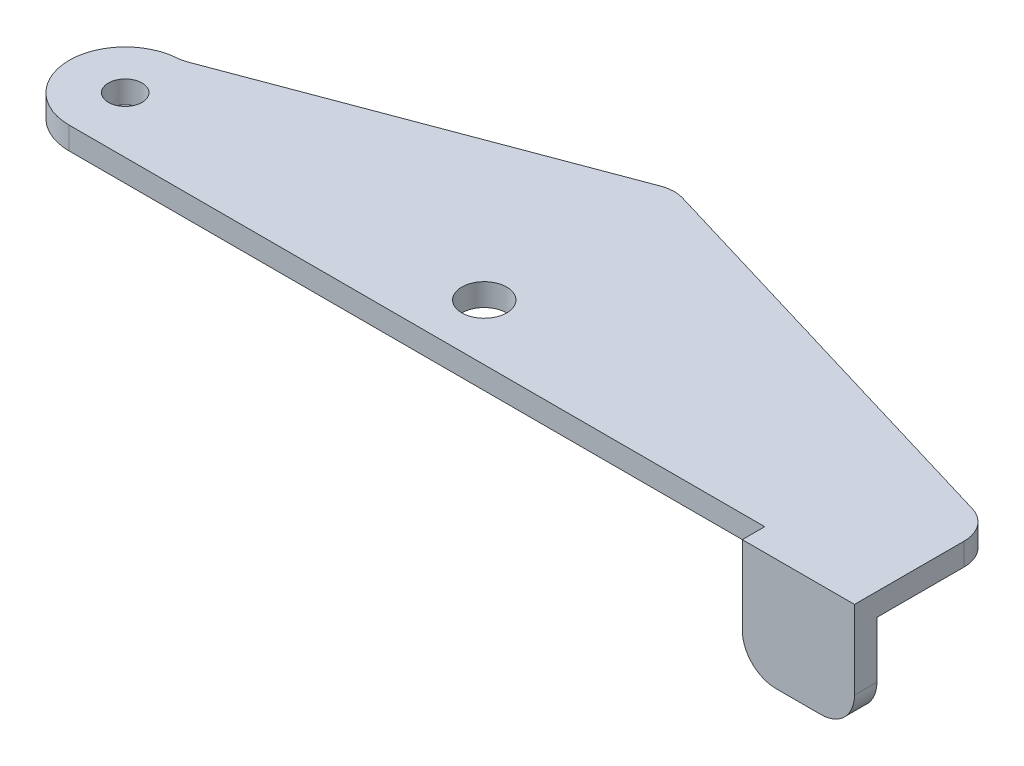
from build123d import *

# Parameters (mm, degrees)
SKETCH_1_R      = 1.5
SKETCH_1_R_2    = 2
EXTRUDE_1_DEPTH = 2
SKETCH_2_W      = 10
SKETCH_2_H      = 2
EXTRUDE_2_DEPTH = 10
FILLET_1_R      = 3
FILLET_2_R      = 3


with BuildPart() as part:
    # 草图1 → 凸台-拉伸1 (new body)
    with BuildSketch(Plane(origin=(0, 0, 0), x_dir=(1, 0, 0), z_dir=(0, 1, 0))):
        with BuildLine():
            Line((-32, 5), (0, 17))
            Line((0, 17), (40, 5))
            Line((40, 5), (40, -5))
            Line((40, -5), (-32, -5))
            ThreePointArc((-32, -5), (-37, 0), (-32, 5))
        make_face()
        with Locations(Location((-32, 0, 0), (0, 0, 270))):
            Circle(SKETCH_1_R, mode=Mode.SUBTRACT)
        with Locations(Location((0, 0, 0), (0, 0, 270))):
            Circle(SKETCH_1_R_2, mode=Mode.SUBTRACT)
    extrude(amount=EXTRUDE_1_DEPTH)

    # 草图2 → 凸台-拉伸2 (add)
    with BuildSketch(Plane(origin=(0, 2, 0), x_dir=(1, 0, 0), z_dir=(0, 1, 0))):
        with Locations((35, -6)):
            Rectangle(SKETCH_2_W, SKETCH_2_H)
    extrude(amount=-EXTRUDE_2_DEPTH)

    # 圆角1
    fillet_1_edges = [part.edges().sort_by_distance(p)[0] for p in [
        (-32, 1, -5),
        (0, 1, -17),
        (40, 1, -5),
    ]]
    fillet(fillet_1_edges, radius=FILLET_1_R)

    # 圆角2
    fillet_2_edges = [part.edges().sort_by_distance(p)[0] for p in [
        (40, -8, 6),
        (30, -8, 6),
    ]]
    fillet(fillet_2_edges, radius=FILLET_2_R)


solid = part.part
